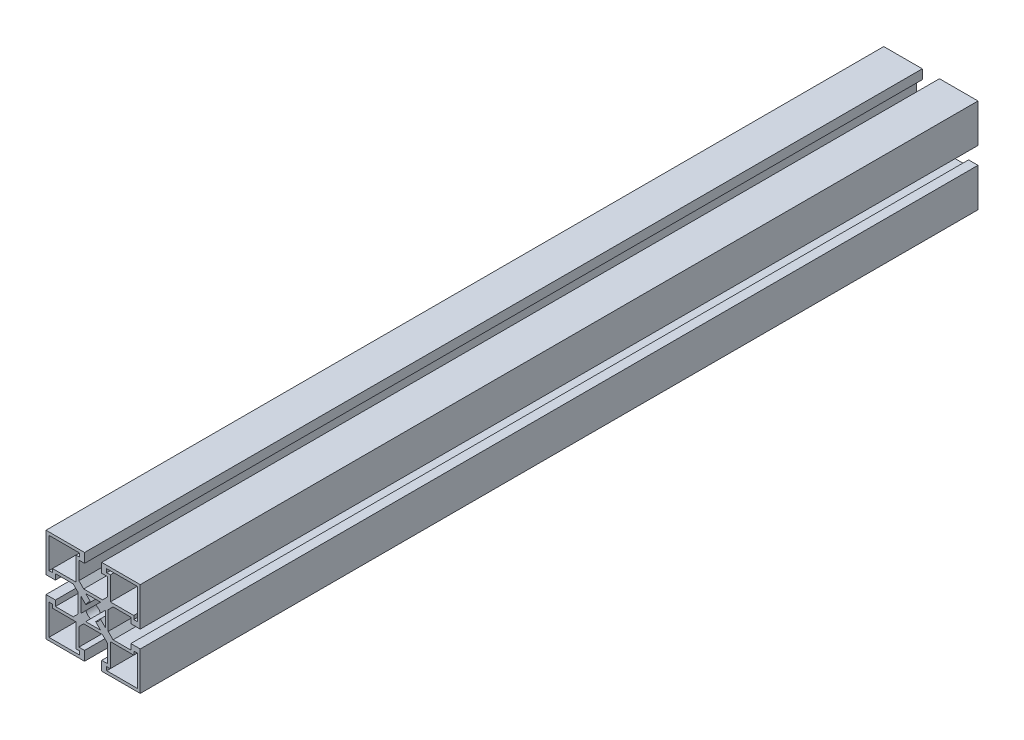
from build123d import *

# Parameters (mm, degrees)
BOSS_EXTRUDE1_DEPTH = 400


with BuildPart() as part:
    # Sketch1 → Boss-Extrude1 (new body)
    with BuildSketch(Plane.XY):
        Polygon((-22.499997904, -22.500007621), (-4.099997904, -22.500007621), (-4.099997904, -18.000007621), (-6.799997904, -18.000007621), (-6.799997904, -9.500007621), (-4.499997904, -7.200007621), (4.500002096, -7.200007621), (6.800002096, -9.500007621), (6.800002096, -18.000007621), (4.100002096, -18.000007621), (4.100002096, -22.500007621), (22.500002096, -22.500007621), (22.500002096, -4.100007621), (18.000002096, -4.100007621), (18.000002096, -6.800007621), (9.500002096, -6.800007621), (7.200002096, -4.500007621), (7.200002096, 4.499992379), (9.500002096, 6.799992379), (18.000002096, 6.799992379), (18.000002096, 4.099992379), (22.500002096, 4.099992379), (22.500002096, 22.499992379), (4.100002096, 22.499992379), (4.100002096, 17.999992379), (6.800002096, 17.999992379), (6.800002096, 9.499992379), (4.500002096, 7.199992379), (-4.499997904, 7.199992379), (-6.799997904, 9.499992379), (-6.799997904, 17.999992379), (-4.099997904, 17.999992379), (-4.099997904, 22.499992379), (-22.499997904, 22.499992379), (-22.499997904, 4.099992379), (-17.999997904, 4.099992379), (-17.999997904, 6.799992379), (-9.499997904, 6.799992379), (-7.199997904, 4.499992379), (-7.199997904, -4.500007621), (-9.499997904, -6.800007621), (-17.999997904, -6.800007621), (-17.999997904, -4.100007621), (-22.499997904, -4.100007621), align=None)
        Polygon((8.200003223, 8.199980186), (8.199989777, 19.399992368), (6.500002085, 19.399992368), (6.500002085, 21.099984758), (21.100004192, 21.099984758), (21.100004192, 6.499980188), (19.400009891, 6.499980188), (19.400009891, 8.199980186), align=None, mode=Mode.SUBTRACT)
        Polygon((-19.399997893, 6.499992368), (-21.099990283, 6.499992368), (-21.099990283, 21.099994475), (-6.499974376, 21.099994475), (-6.49997587, 19.399985233), (-8.199975868, 19.399986727), (-8.199985712, 8.19998006), (-19.399997893, 8.19998006), align=None, mode=Mode.SUBTRACT)
        Polygon((-6.499997893, -21.1), (-21.1, -21.1), (-21.1, -6.499995431), (-19.400002096, -6.499995431), (-19.400002096, -8.199995429), (-8.199995429, -8.199995429), (-8.199995429, -19.40000761), (-6.499997893, -19.400009104), align=None, mode=Mode.SUBTRACT)
        Polygon((6.499989905, -19.400011813), (8.199989903, -19.400011813), (8.199989903, -8.200005146), (19.400002085, -8.200005146), (19.400003579, -6.500017454), (21.099994475, -6.500018948), (21.099994475, -21.100009717), (6.499989905, -21.100009717), align=None, mode=Mode.SUBTRACT)
        with BuildLine():
            Line((-5.799999723, 3.537265469), (-3.451121085, 1.18838683))
            ThreePointArc((-3.451121085, 1.18838683), (-2.580942431, 2.580937072), (-1.188393996, 3.451118617))
            Line((-1.188393996, 3.451118617), (-3.537277512, 5.799992379))
            Line((-3.537277512, 5.799992379), (3.537277512, 5.799992379))
            Line((3.537277512, 5.799992379), (1.188393996, 3.451118617))
            ThreePointArc((1.188393996, 3.451118617), (2.580942431, 2.580937072), (3.451121085, 1.18838683))
            Line((3.451121085, 1.18838683), (5.799999723, 3.537265469))
            Line((5.799999723, 3.537265469), (5.799985034, -3.537266022))
            Line((5.799985034, -3.537266022), (3.451117181, -1.188398168))
            ThreePointArc((3.451117181, -1.188398168), (2.580938191, -2.580941312), (1.188393996, -3.451118617))
            Line((1.188393996, -3.451118617), (3.537277512, -5.799992379))
            Line((3.537277512, -5.799992379), (-3.537277512, -5.799992379))
            Line((-3.537277512, -5.799992379), (-1.188393996, -3.451118617))
            ThreePointArc((-1.188393996, -3.451118617), (-2.580938191, -2.580941311), (-3.451117181, -1.188398168))
            Line((-3.451117181, -1.188398168), (-5.799985034, -3.537266022))
            Line((-5.799985034, -3.537266022), (-5.799999723, 3.537265469))
        make_face(mode=Mode.SUBTRACT)
    extrude(amount=BOSS_EXTRUDE1_DEPTH)


solid = part.part
